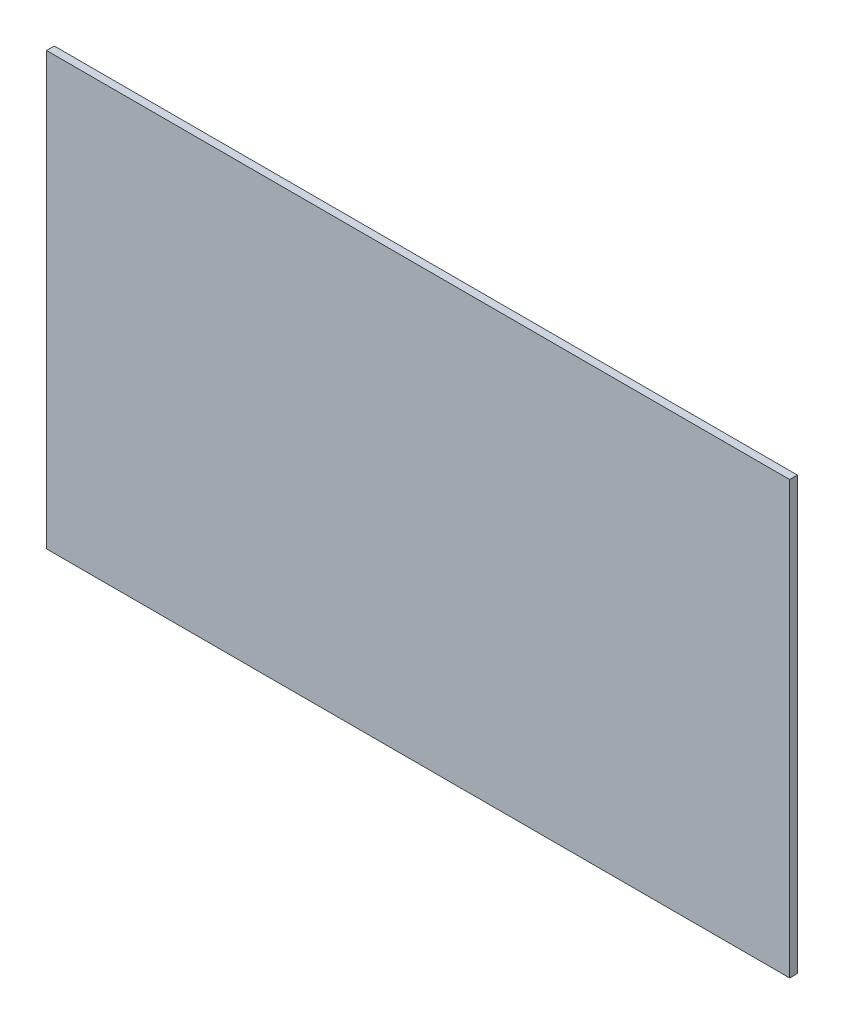
from build123d import *

# Parameters (mm, degrees)
SKETCH1_W           = 304.8
SKETCH1_H           = 177.038
BOSS_EXTRUDE1_DEPTH = 3.175


with BuildPart() as part:
    # Sketch1 → Boss-Extrude1 (new body)
    with BuildSketch(Plane.XY):
        with Locations((152.4, -88.519)):
            Rectangle(SKETCH1_W, SKETCH1_H)
    extrude(amount=BOSS_EXTRUDE1_DEPTH)


solid = part.part
